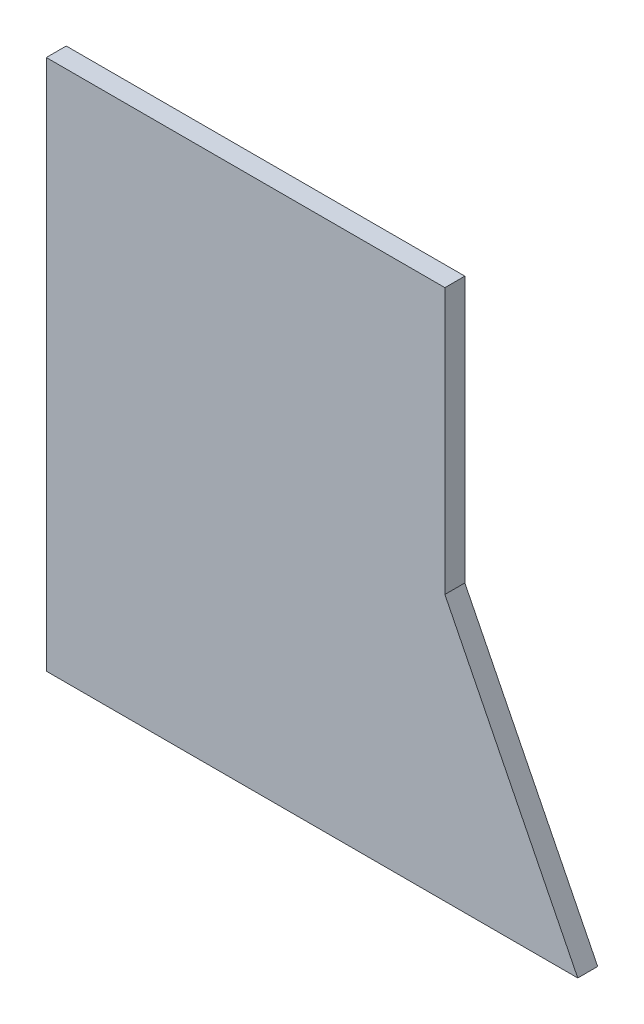
from build123d import *

# Parameters (mm, degrees)
BOSS_EXTRUDE2_DEPTH = 0.015


with BuildPart() as part:
    # Sketch1 → Boss-Extrude2 (new, symmetric)
    with BuildSketch(Plane.XY):
        Polygon((0.3, 0), (0.5, -0.4), (0.3, -0.4), (-0.3, -0.4), (-0.3, 0.4), (0.3, 0.4), align=None)
    extrude(amount=BOSS_EXTRUDE2_DEPTH, both=True)


solid = part.part
